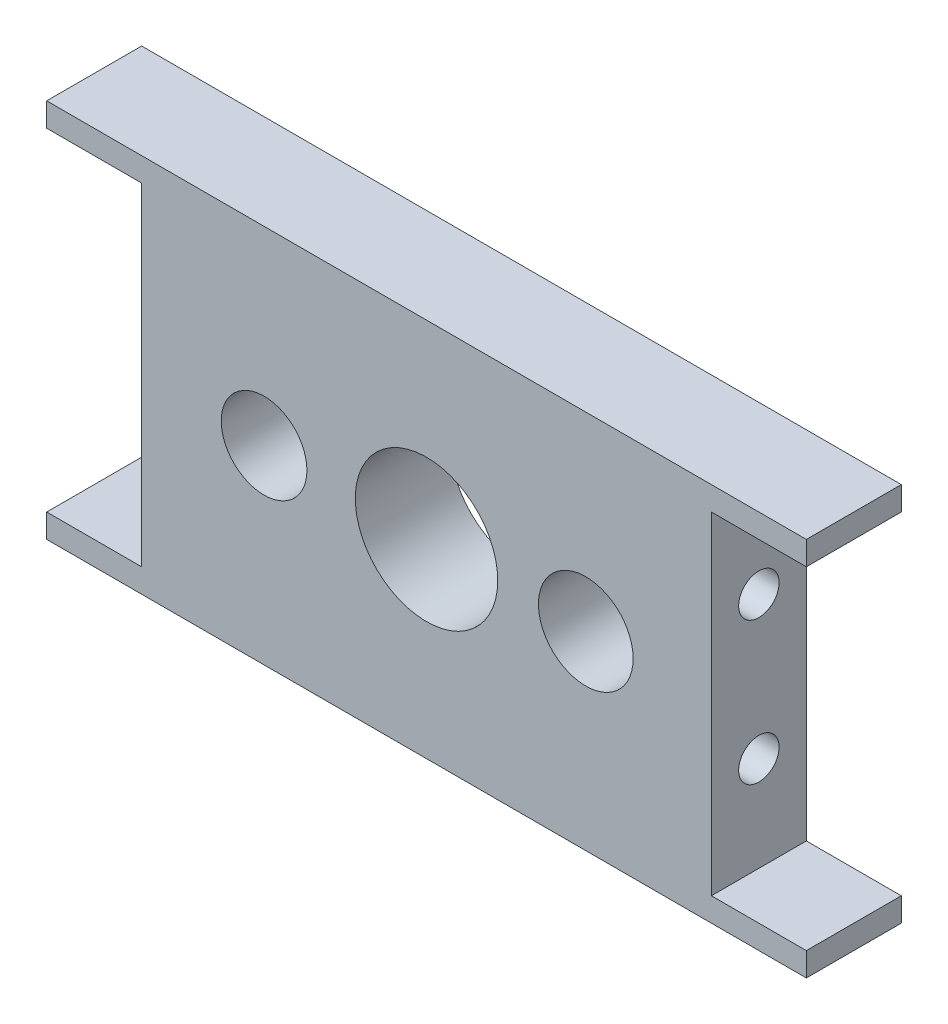
from build123d import *

# Parameters (mm, degrees)
SKETCH1_R                          = 4.7625
SKETCH1_R_2                        = 2.86564839
SKETCH1_R_3                        = 3.16650189
BOSS_EXTRUDE1_DEPTH                = 6.35
TAP_DRILL_FOR_6_32_TAP1_AT_2_COUNT = 2
TAP_DRILL_FOR_6_32_TAP1_AT_2_PITCH = 9.525


with BuildPart() as part:
    # Sketch1 → Boss-Extrude1 (new body)
    with BuildSketch(Plane.XY):
        Polygon((25.4, -11.1125), (25.4, -12.7), (-25.4, -12.7), (-25.4, -11.1125), (-19.05, -11.1125), (-19.05, 11.1125), (-25.4, 11.1125), (-25.4, 12.7), (25.4, 12.7), (25.4, 11.1125), (19.05, 11.1125), (19.05, -11.1125), align=None)
        Circle(SKETCH1_R, mode=Mode.SUBTRACT)
        with Locations((-10.863100334, 0)):
            Circle(SKETCH1_R_2, mode=Mode.SUBTRACT)
        with Locations((10.650098366, 0)):
            Circle(SKETCH1_R_3, mode=Mode.SUBTRACT)
    extrude(amount=BOSS_EXTRUDE1_DEPTH)

    # Sketch4 → Tap Drill for #6-32 Tap1 (revolve, cut)
    with BuildSketch(Plane(origin=(19.05, 4.7625, 3.175), x_dir=(0, 0, -1), z_dir=(0, 1, 0))):
        Polygon((0, 0), (0, 7.16269403), (1.35255, 6.35), (1.35255, 0), align=None)
    tap_drill_for_6_32_tap1 = revolve(axis=Axis((25.4, 4.7625, 3.175), (-1, 0, 0)), mode=Mode.SUBTRACT)

    # Tap Drill for #6-32 Tap1 at 2: Tap Drill for #6-32 Tap1 ×2
    with Locations(*[(0, -i * TAP_DRILL_FOR_6_32_TAP1_AT_2_PITCH, 0) for i in range(1, TAP_DRILL_FOR_6_32_TAP1_AT_2_COUNT)]):
        add(tap_drill_for_6_32_tap1, mode=Mode.SUBTRACT)

    # Mirror1: Tap Drill for #6-32 Tap1 across plane
    add(tap_drill_for_6_32_tap1.mirror(Plane.ZY), mode=Mode.SUBTRACT)

    # Mirror1 copy 1 sketch → Mirror1 copy 1 (revolve, cut)
    with BuildSketch(Plane(origin=(-19.05, -4.7625, 3.175), x_dir=(0, 0, -1), z_dir=(0, 1, 0))):
        Polygon((0, 0), (0, -7.16269403), (1.35255, -6.35), (1.35255, 0), align=None)
    revolve(axis=Axis((-25.4, -4.7625, 3.175), (-1, 0, 0)), mode=Mode.SUBTRACT)


solid = part.part
